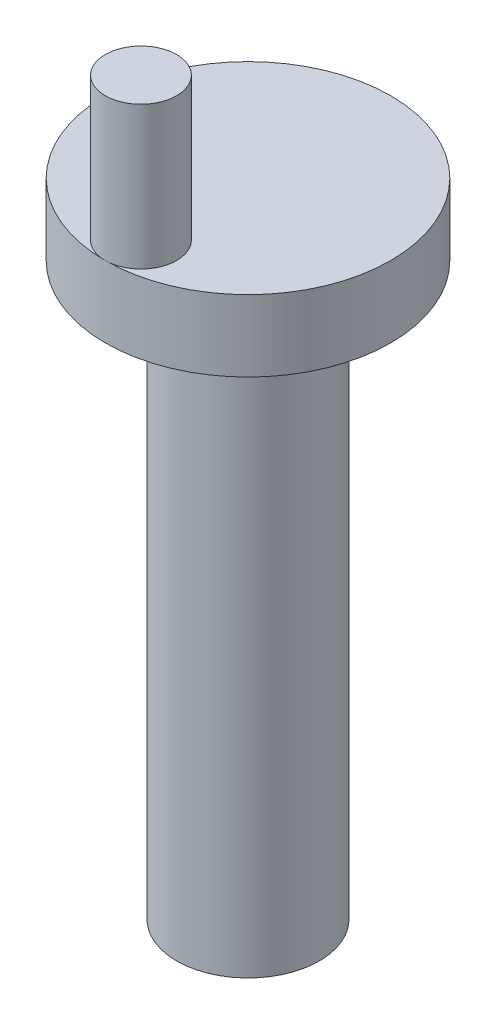
from build123d import *

# Parameters (mm, degrees)
SKETCH1_R           = 2.54
BOSS_EXTRUDE1_DEPTH = 20.32
SKETCH2_R           = 5.08
BOSS_EXTRUDE2_DEPTH = 2.54
SKETCH3_R           = 1.27
BOSS_EXTRUDE3_DEPTH = 5.08


with BuildPart() as part:
    # Sketch1 → Boss-Extrude1 (new body)
    with BuildSketch(Plane(origin=(0, 0, 0), x_dir=(1, 0, 0), z_dir=(0, 1, 0))):
        Circle(SKETCH1_R)
    extrude(amount=BOSS_EXTRUDE1_DEPTH)

    # Sketch2 → Boss-Extrude2 (add)
    with BuildSketch(Plane(origin=(0, 20.32, 0), x_dir=(1, 0, 0), z_dir=(0, 1, 0))):
        Circle(SKETCH2_R)
    extrude(amount=BOSS_EXTRUDE2_DEPTH)

    # Sketch3 → Boss-Extrude3 (add)
    with BuildSketch(Plane(origin=(0, 22.86, 0), x_dir=(1, 0, 0), z_dir=(0, 1, 0))):
        with Locations((0, -3.81)):
            Circle(SKETCH3_R)
    extrude(amount=BOSS_EXTRUDE3_DEPTH)


solid = part.part
